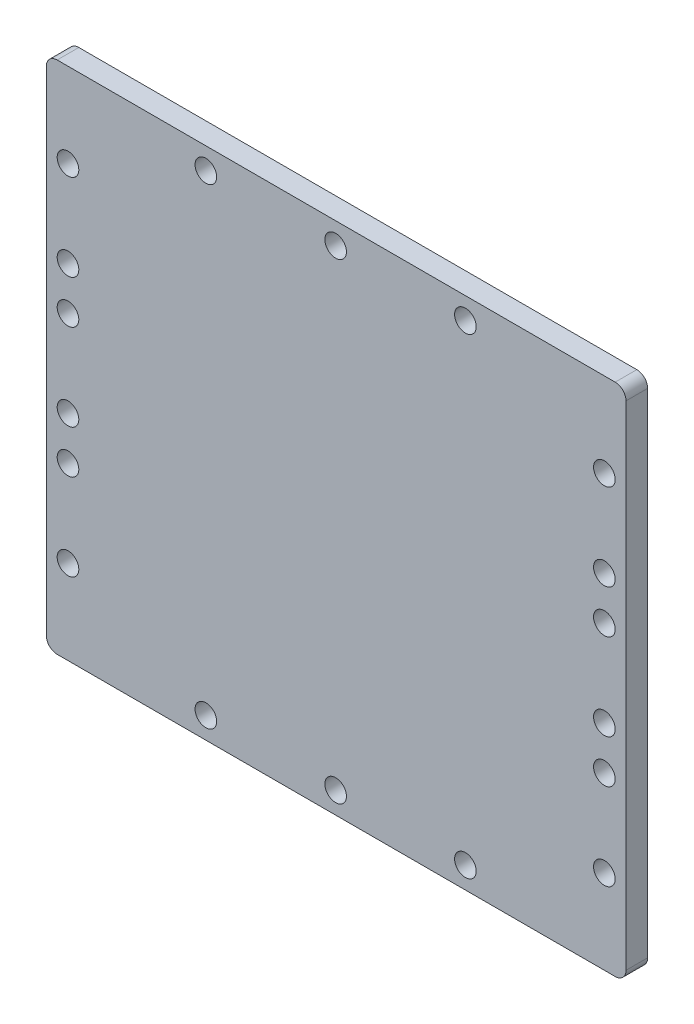
from build123d import *

# Parameters (mm, degrees)
SKETCH_1_R      = 1
EXTRUDE_1_DEPTH = 2


with BuildPart() as part:
    # 草圖1 → 填料-伸長1 (new body)
    with BuildSketch(Plane.XY):
        with BuildLine():
            Line((-35.200489897, 20.825), (16.399510103, 20.825))
            ThreePointArc((16.399510103, 20.825), (17.106616884, 20.532106781), (17.399510103, 19.825))
            Line((17.399510103, 19.825), (17.399510103, -25.775))
            ThreePointArc((17.399510103, -25.775), (17.106616884, -26.482106781), (16.399510103, -26.775))
            Line((16.399510103, -26.775), (-35.200489897, -26.775))
            ThreePointArc((-35.200489897, -26.775), (-35.907596678, -26.482106781), (-36.200489897, -25.775))
            Line((-36.200489897, -25.775), (-36.200489897, 19.825))
            ThreePointArc((-36.200489897, 19.825), (-35.907596678, 20.532106781), (-35.200489897, 20.825))
        make_face()
        with Locations((-9.450489897, 18.825)):
            Circle(SKETCH_1_R, mode=Mode.SUBTRACT)
        with Locations((-9.450489897, -24.775)):
            Circle(SKETCH_1_R, mode=Mode.SUBTRACT)
        with Locations((15.399510103, 1.025)):
            Circle(SKETCH_1_R, mode=Mode.SUBTRACT)
        with Locations((-34.200489897, 1.025)):
            Circle(SKETCH_1_R, mode=Mode.SUBTRACT)
        with Locations((-34.200489897, -6.975)):
            Circle(SKETCH_1_R, mode=Mode.SUBTRACT)
        with Locations((15.399510103, -6.975)):
            Circle(SKETCH_1_R, mode=Mode.SUBTRACT)
        with Locations((-34.200489897, 13.025)):
            Circle(SKETCH_1_R, mode=Mode.SUBTRACT)
        with Locations((-34.200489897, 5.025)):
            Circle(SKETCH_1_R, mode=Mode.SUBTRACT)
        with Locations((-34.200489897, -10.975)):
            Circle(SKETCH_1_R, mode=Mode.SUBTRACT)
        with Locations((-34.200489897, -18.975)):
            Circle(SKETCH_1_R, mode=Mode.SUBTRACT)
        with Locations((15.399510103, 13.025)):
            Circle(SKETCH_1_R, mode=Mode.SUBTRACT)
        with Locations((15.399510103, 5.025)):
            Circle(SKETCH_1_R, mode=Mode.SUBTRACT)
        with Locations((15.399510103, -10.975)):
            Circle(SKETCH_1_R, mode=Mode.SUBTRACT)
        with Locations((15.399510103, -18.975)):
            Circle(SKETCH_1_R, mode=Mode.SUBTRACT)
        with Locations((-21.450489897, 18.825)):
            Circle(SKETCH_1_R, mode=Mode.SUBTRACT)
        with Locations((2.549510103, 18.825)):
            Circle(SKETCH_1_R, mode=Mode.SUBTRACT)
        with Locations((-21.450489897, -24.775)):
            Circle(SKETCH_1_R, mode=Mode.SUBTRACT)
        with Locations((2.549510103, -24.775)):
            Circle(SKETCH_1_R, mode=Mode.SUBTRACT)
    extrude(amount=EXTRUDE_1_DEPTH)


solid = part.part
